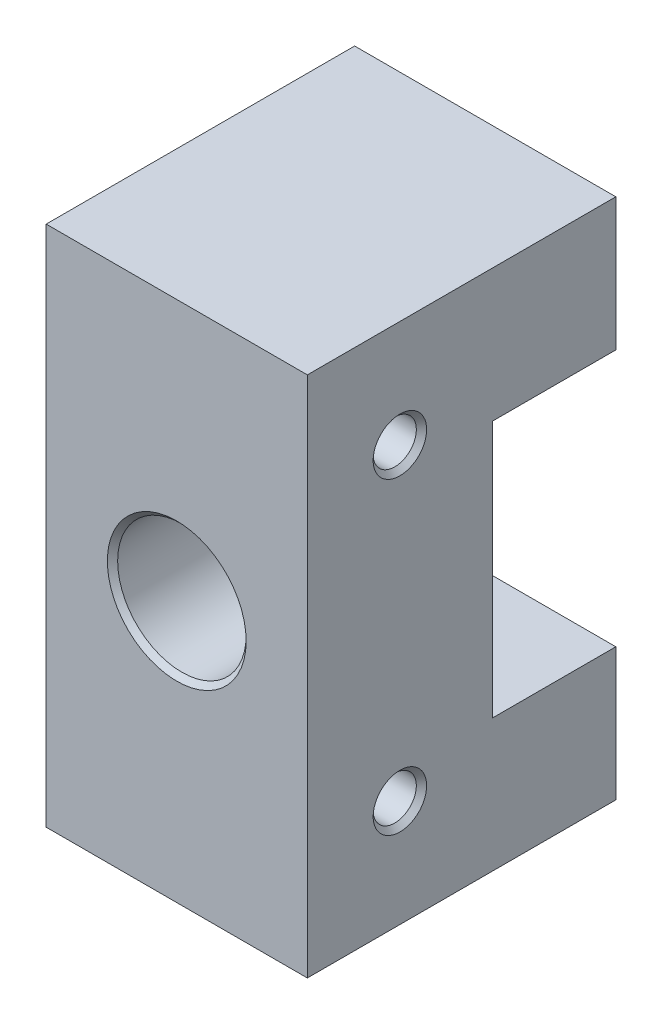
from build123d import *

# Parameters (mm, degrees)
SKETCH1_W                      = 25.4
SKETCH1_H                      = 50.8
BOSS_EXTRUDE1_DEPTH            = 30
SKETCH2_W                      = 25.4
SKETCH2_H                      = 25
CUT_EXTRUDE1_DEPTH             = 12
M12_CLEARANCE_HOLE1_D          = 12.5
M5X0_8_TAPPED_HOLE1_AT_2_COUNT = 2
M5X0_8_TAPPED_HOLE1_AT_2_PITCH = 30
CHAMFER1_0_5_MM_SIZE           = 0.5


with BuildPart() as part:
    # Sketch1 → Boss-Extrude1 (new body)
    with BuildSketch(Plane.XY):
        Rectangle(SKETCH1_W, SKETCH1_H)
    extrude(amount=BOSS_EXTRUDE1_DEPTH)

    # Sketch2 → Cut-Extrude1 (cut)
    with BuildSketch(Plane.XY):
        Rectangle(SKETCH2_W, SKETCH2_H)
    extrude(amount=CUT_EXTRUDE1_DEPTH, mode=Mode.SUBTRACT)

    # M12 Clearance Hole1 (through all)
    with Locations(Plane(origin=(0, 0, 12), x_dir=(-1, 0, 0), z_dir=(0, 0, -1))):
        with Locations((0, 0)):
            Hole(M12_CLEARANCE_HOLE1_D / 2)

    # Sketch11 → M5x0.8 Tapped Hole1 (revolve, cut)
    with BuildSketch(Plane(origin=(12.7, 15, 21), x_dir=(0, 0, -1), z_dir=(0, 1, 0))):
        Polygon((0, 0), (0, 12), (2.1, 10.7381927), (2.1, 0), align=None)
    m5x0_8_tapped_hole1 = revolve(axis=Axis((19.05, 15, 21), (-1, 0, 0)), mode=Mode.SUBTRACT)

    # M5x0.8 Tapped Hole1 at 2: M5x0.8 Tapped Hole1 ×2
    with Locations(*[(0, -i * M5X0_8_TAPPED_HOLE1_AT_2_PITCH, 0) for i in range(1, M5X0_8_TAPPED_HOLE1_AT_2_COUNT)]):
        add(m5x0_8_tapped_hole1, mode=Mode.SUBTRACT)

    # Mirror1: M5x0.8 Tapped Hole1 across plane
    add(m5x0_8_tapped_hole1.mirror(Plane(origin=(0, 0, 0), x_dir=(0, 0, 1), z_dir=(1, 0, 0))), mode=Mode.SUBTRACT)

    # Mirror1 copy 1 sketch → Mirror1 copy 1 (revolve, cut)
    with BuildSketch(Plane(origin=(-12.7, -15, 21), x_dir=(0, 0, -1), z_dir=(0, 1, 0))):
        Polygon((0, 0), (0, -12), (2.1, -10.7381927), (2.1, 0), align=None)
    revolve(axis=Axis((-19.05, -15, 21), (-1, 0, 0)), mode=Mode.SUBTRACT)

    # Chamfer1 0.5 mm
    chamfer1_0_5_mm_edges = [part.edges().sort_by_distance(p)[0] for p in [
        (-6.25, 0, 12),
        (-6.25, 0, 30),
        (12.7, -15, 23.1),
        (12.7, 15, 23.1),
        (-12.7, -15, 23.1),
        (-12.7, 15, 23.1),
    ]]
    chamfer(chamfer1_0_5_mm_edges, length=CHAMFER1_0_5_MM_SIZE)


solid = part.part
